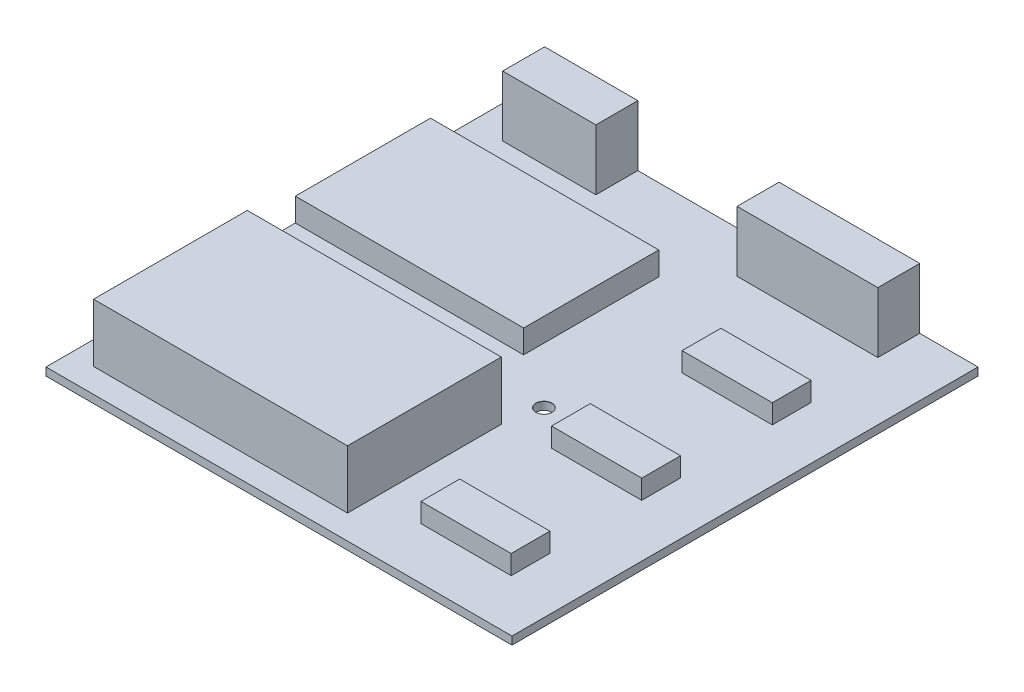
from build123d import *

# Parameters (mm, degrees)
SKETCH1_W                     = 100
SKETCH1_H                     = 100
BOSS_EXTRUDE1_DEPTH           = 1.7
SKETCH2_W                     = 30.2
SKETCH2_H                     = 9
SKETCH2_W_2                   = 20
BOSS_EXTRUDE2_DEPTH           = 13
SKETCH3_W                     = 49
SKETCH3_H                     = 29
BOSS_EXTRUDE3_DEPTH           = 5
SKETCH4_W                     = 19.36
SKETCH4_H                     = 8.32
BOSS_EXTRUDE4_DEPTH           = 4.13
SKETCH5_W                     = 54.5
SKETCH5_H                     = 33
BOSS_EXTRUDE5_DEPTH           = 12.5
M3_CLEARANCE_HOLE1_AT_2_COUNT = 2
M3_CLEARANCE_HOLE1_AT_2_PITCH = 48


with BuildPart() as part:
    # Sketch1 → Boss-Extrude1 (new body)
    with BuildSketch(Plane(origin=(0, 0, 0), x_dir=(1, 0, 0), z_dir=(0, 1, 0))):
        Rectangle(SKETCH1_W, SKETCH1_H)
    extrude(amount=BOSS_EXTRUDE1_DEPTH)

    # Sketch2 → Boss-Extrude2 (add)
    with BuildSketch(Plane(origin=(0, 1.7, 0), x_dir=(1, 0, 0), z_dir=(0, 1, 0))):
        with Locations((22.4, 45.5)):
            Rectangle(SKETCH2_W, SKETCH2_H)
        with Locations((-33, 45.5)):
            Rectangle(SKETCH2_W_2, SKETCH2_H)
    extrude(amount=BOSS_EXTRUDE2_DEPTH)

    # Sketch3 → Boss-Extrude3 (add)
    with BuildSketch(Plane(origin=(0, 1.7, 0), x_dir=(1, 0, 0), z_dir=(0, 1, 0))):
        with Locations((-25.5, 18)):
            Rectangle(SKETCH3_W, SKETCH3_H)
    extrude(amount=BOSS_EXTRUDE3_DEPTH)

    # Sketch4 → Boss-Extrude4 (add)
    with BuildSketch(Plane(origin=(0, 1.7, 0), x_dir=(1, 0, 0), z_dir=(0, 1, 0))):
        with Locations((29.02, 21.32)):
            Rectangle(SKETCH4_W, SKETCH4_H)
        with Locations((29.02, -6.7)):
            Rectangle(SKETCH4_W, SKETCH4_H)
        with Locations((29.02, -34.72)):
            Rectangle(SKETCH4_W, SKETCH4_H)
    extrude(amount=BOSS_EXTRUDE4_DEPTH)

    # Sketch5 → Boss-Extrude5 (add)
    with BuildSketch(Plane(origin=(0, 1.7, 0), x_dir=(1, 0, 0), z_dir=(0, 1, 0))):
        with Locations((-17.75, -28.3)):
            Rectangle(SKETCH5_W, SKETCH5_H)
    extrude(amount=BOSS_EXTRUDE5_DEPTH)

    # Sketch9 → M3 Clearance Hole1 (revolve, cut)
    with BuildSketch(Plane(origin=(-37, 1.7, 4.15), x_dir=(0, 0, 1), z_dir=(1, 0, 0))):
        Polygon((0, 0), (0, 1.7), (1.7, 1.7), (1.7, 0.025), (1.725, 0), align=None)
    m3_clearance_hole1 = revolve(axis=Axis((-37, 8.05, 4.15), (0, -1, 0)), mode=Mode.SUBTRACT)

    # M3 Clearance Hole1 at 2: M3 Clearance Hole1 ×2
    with Locations(*[(i * M3_CLEARANCE_HOLE1_AT_2_PITCH, 0, 0) for i in range(1, M3_CLEARANCE_HOLE1_AT_2_COUNT)]):
        add(m3_clearance_hole1, mode=Mode.SUBTRACT)


solid = part.part
